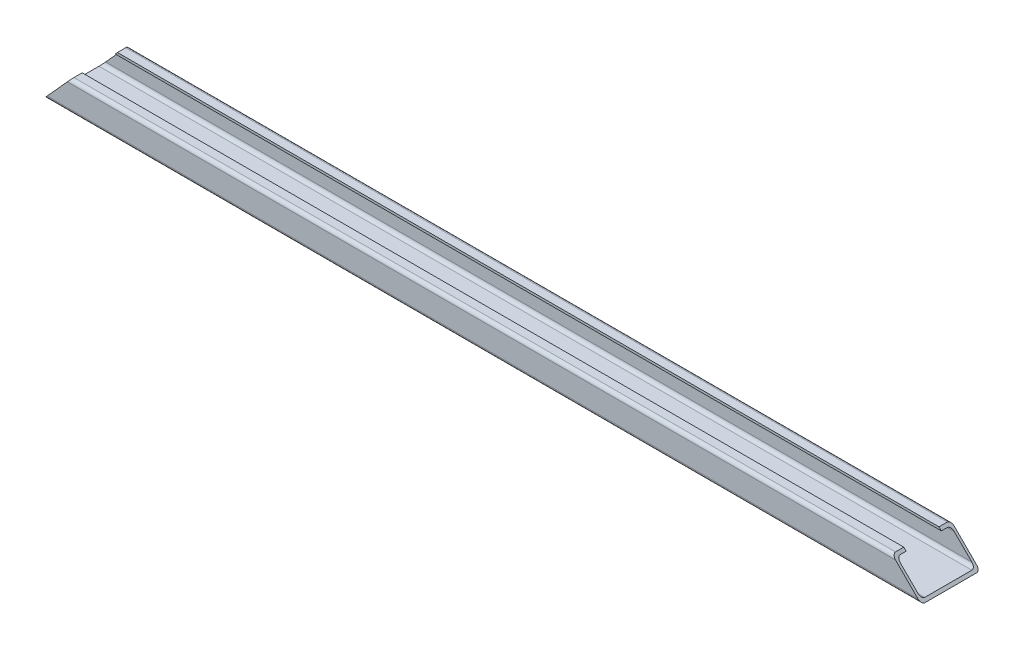
from build123d import *

# Parameters (mm, degrees)
RESSALTO_EXTRUS_O1_DEPTH = 1500
FILETE1_R                = 6
CORTE_EXTRUS_O1_DEPTH    = 50
CORTE_EXTRUS_O2_DEPTH    = 50


with BuildPart() as part:
    # Esboço1 → Ressalto-extrusão1 (new body)
    with BuildSketch(Plane(origin=(0, 0, 0), x_dir=(0, 0, -1), z_dir=(1, 0, 0))):
        Polygon((-46, 21), (-46, -21), (46, -21), (46, 21), (30, 21), (30, 25), (50, 25), (50, -25), (-50, -25), (-50, 25), (-30, 25), (-30, 21), align=None)
    extrude(amount=RESSALTO_EXTRUS_O1_DEPTH)

    # Filete1
    filete1_edges = [part.edges().sort_by_distance(p)[0] for p in [
        (750, -25, -50),
        (750, -25, 50),
        (750, 25, 50),
        (750, 21, 46),
        (750, -21, 46),
        (750, -21, -46),
        (750, 21, -46),
        (750, 25, -50),
    ]]
    fillet(filete1_edges, radius=FILETE1_R)

    # Esboço3 → Corte-extrusão1 (cut, symmetric)
    with BuildSketch(Plane.XY):
        Polygon((0, -25), (184.767559257, 159.767559257), (-208.615442636, 104.939092506), align=None)
        Polygon((1500, -25), (1327.707280818, 147.292719182), (1799.383443157, 147.292719182), align=None)
    extrude(amount=CORTE_EXTRUS_O1_DEPTH, both=True, mode=Mode.SUBTRACT)

    # Esboço4 → Corte-extrusão2 (cut, symmetric)
    with BuildSketch(Plane.XY):
        Polygon((50, 25), (-16.235639867, -48.562130564), (-42.129730134, -17.715767118), align=None)
    extrude(amount=CORTE_EXTRUS_O2_DEPTH, both=True, mode=Mode.SUBTRACT)


solid = part.part
